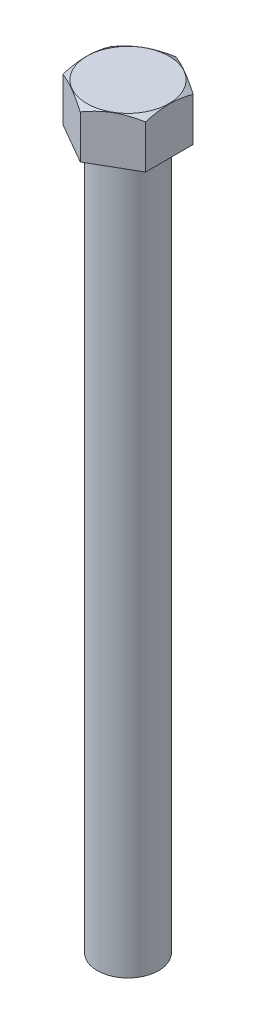
from build123d import *

# Parameters (mm, degrees)
BOSS_EXTRUDE1_DEPTH = 0.1
SKETCH3_OUTSIDE_W   = 3.156
SKETCH3_OUTSIDE_H   = 3.21
SKETCH3_OUTSIDE_R   = 0.17388888
CUT_EXTRUDE1_DEPTH  = 0.2
CUT_EXTRUDE1_DRAFT  = -60
SKETCH4_R           = 0.13
BOSS_EXTRUDE2_DEPTH = 3


with BuildPart() as part:
    # Sketch2 → Boss-Extrude1 (new, symmetric)
    with BuildSketch(Plane(origin=(0, 0, 0), x_dir=(1, 0, 0), z_dir=(0, 1, 0))):
        Polygon((0, -0.202072594), (0.175, -0.101036297), (0.175, 0.101036297), (0, 0.202072594), (-0.175, 0.101036297), (-0.175, -0.101036297), align=None)
    extrude(amount=BOSS_EXTRUDE1_DEPTH, both=True)


with BuildPart() as cut_extrude1_tool:
    # Sketch3 outside → Cut-Extrude1 (with draft: the straight prism first)
    with BuildSketch(Plane(origin=(0, 0.1, 0), x_dir=(1, 0, 0), z_dir=(0, 1, 0))):
        Rectangle(SKETCH3_OUTSIDE_W, SKETCH3_OUTSIDE_H)
        Circle(SKETCH3_OUTSIDE_R, mode=Mode.SUBTRACT)
    extrude(amount=-CUT_EXTRUDE1_DEPTH)
    # Cut-Extrude1: the draft: its side faces are tilted about the plane it starts from
    cut_extrude1_sides = [cut_extrude1_tool.faces().sort_by_distance(p)[0] for p in [
        (0, 0, 1.605),
        (1.578, 0, 0),
        (0, 0, -1.605),
        (-1.578, 0, 0),
        (-0.17388888, 0, 0),
    ]]
    draft(cut_extrude1_sides, Plane(origin=(0, 0.1, 0), x_dir=(1, 0, 0), z_dir=(0, 1, 0)), CUT_EXTRUDE1_DRAFT)


with BuildPart() as part_1:
    add(part.part)

    # Cut-Extrude1: cut by cut_extrude1_tool
    add(cut_extrude1_tool.part, mode=Mode.SUBTRACT)

    # Sketch4 → Boss-Extrude2 (add)
    with BuildSketch(Plane.XZ.offset(0.1)):
        with Locations(Location((0, 0, 0), (0, 0, 270))):
            Circle(SKETCH4_R)
    extrude(amount=BOSS_EXTRUDE2_DEPTH)


solid = part_1.part
